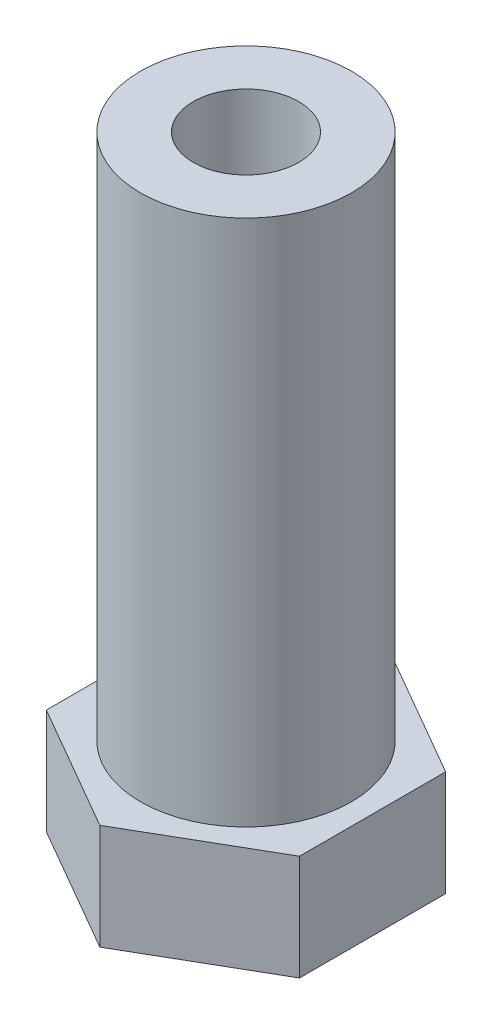
from build123d import *

# Parameters (mm, degrees)
SKETCH_1_R      = 2
EXTRUDE_1_DEPTH = 5
SKETCH_2_R      = 5
SKETCH_2_R_2    = 2.5
EXTRUDE_2_DEPTH = 25


with BuildPart() as part:
    # 草图1 → 凸台-拉伸1 (new body)
    with BuildSketch(Plane(origin=(0, 0, 0), x_dir=(1, 0, 0), z_dir=(0, 1, 0))):
        Polygon((0, 6.92820323), (-6, 3.464101615), (-6, -3.464101615), (0, -6.92820323), (6, -3.464101615), (6, 3.464101615), align=None)
        with Locations(Location((0, 0, 0), (0, 0, 270))):
            Circle(SKETCH_1_R, mode=Mode.SUBTRACT)
    extrude(amount=EXTRUDE_1_DEPTH)

    # 草图2 → 凸台-拉伸2 (add)
    with BuildSketch(Plane(origin=(0, 5, 0), x_dir=(1, 0, 0), z_dir=(0, 1, 0))):
        with Locations(Location((0, 0, 0), (0, 0, 270))):
            Circle(SKETCH_2_R)
        with Locations(Location((0, 0, 0), (0, 0, 270))):
            Circle(SKETCH_2_R_2, mode=Mode.SUBTRACT)
    extrude(amount=EXTRUDE_2_DEPTH)


solid = part.part
